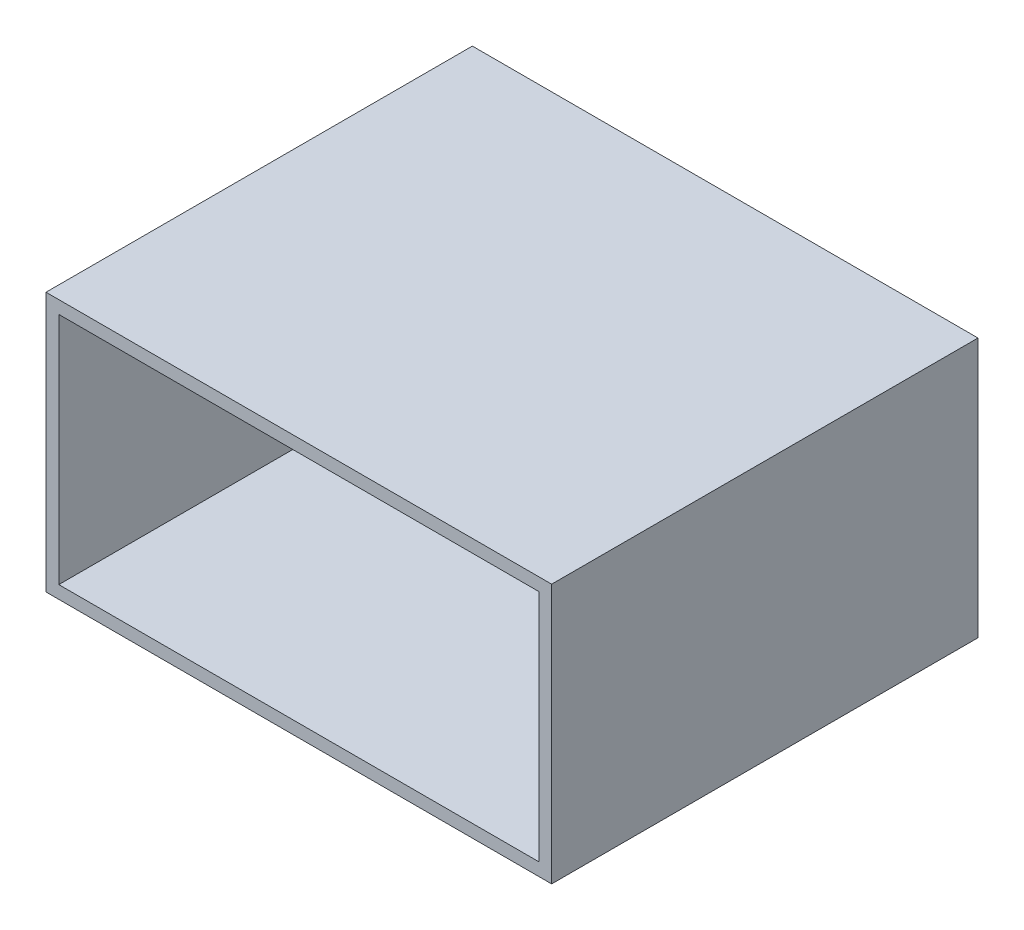
from build123d import *

# Parameters (mm, degrees)
SKETCH1_W           = 394.926652775
SKETCH1_H           = 202.769674437
BOSS_EXTRUDE1_DEPTH = 333
SHELL5_T            = -10
BOSS_EXTRUDE2_DEPTH = 7
SKETCH19_R          = 24.92303726
CUT_EXTRUDE1_DEPTH  = 14
BOSS_EXTRUDE3_DEPTH = 7
SKETCH23_R          = 24.92303726
CUT_EXTRUDE2_DEPTH  = 14


with BuildPart() as part:
    # Sketch1 → Boss-Extrude1 (new body)
    with BuildSketch(Plane.XY):
        with Locations((197.463326388, 101.384837219)):
            Rectangle(SKETCH1_W, SKETCH1_H)
    extrude(amount=BOSS_EXTRUDE1_DEPTH)

    # Shell5
    shell5_openings = [part.faces().sort_by_distance(p)[0] for p in [
        (197.463326387, 101.384837219, 333),
    ]]
    offset(amount=SHELL5_T, openings=shell5_openings, kind=Kind.INTERSECTION)

    # Sketch18 → Boss-Extrude2 (add, symmetric)
    with BuildSketch(Plane.XY.offset(166.5)):
        with BuildLine():
            Line((10, 128.355944405), (81.814439739, 128.355944405))
            ThreePointArc((81.814439739, 128.355944405), (117.012291579, 93.158092565), (81.814439739, 57.960240724))
            Line((81.814439739, 57.960240724), (10, 57.960240724))
            Line((10, 57.960240724), (10, 128.355944405))
        make_face()
    extrude(amount=BOSS_EXTRUDE2_DEPTH, both=True)

    # Sketch19 → Cut-Extrude1 (cut)
    with BuildSketch(Plane.XY.offset(173.5)):
        with Locations((81.814439739, 93.158092565)):
            Circle(SKETCH19_R)
    extrude(amount=-CUT_EXTRUDE1_DEPTH, mode=Mode.SUBTRACT)

    # Sketch22 → Boss-Extrude3 (add, symmetric)
    with BuildSketch(Plane.XY.offset(166.5)):
        with BuildLine():
            Line((384.926652775, 128.355944405), (291.108955259, 128.355944405))
            ThreePointArc((291.108955259, 128.355944405), (256.621992249, 93.868981396), (291.108955259, 59.382018386))
            Line((291.108955259, 59.382018386), (384.926652775, 59.382018386))
            Line((384.926652775, 59.382018386), (384.926652775, 128.355944405))
        make_face()
    extrude(amount=BOSS_EXTRUDE3_DEPTH, both=True)

    # Sketch23 → Cut-Extrude2 (cut)
    with BuildSketch(Plane.XY.offset(173.5)):
        with Locations((291.108955259, 93.868981396)):
            Circle(SKETCH23_R)
    extrude(amount=-CUT_EXTRUDE2_DEPTH, mode=Mode.SUBTRACT)


solid = part.part
